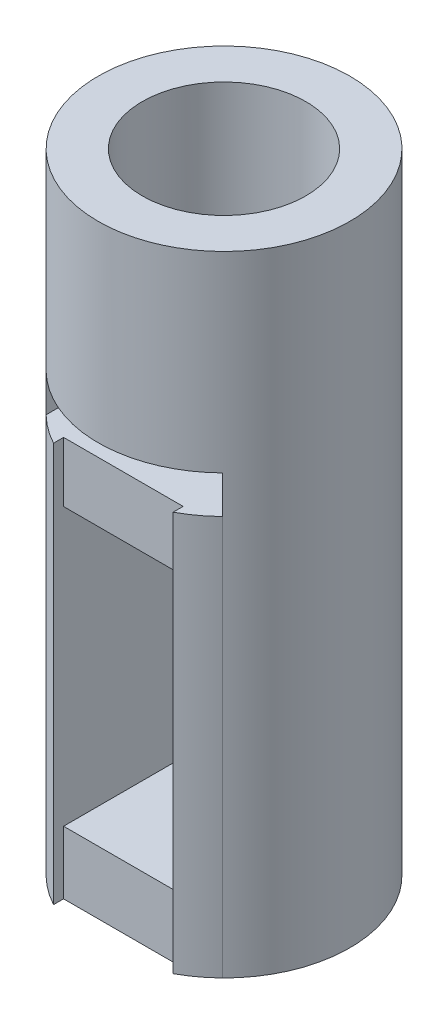
from build123d import *

# Parameters (mm, degrees)
SKETCH_1_R          = 10
EXTRUDE_1_DEPTH     = 50
SKETCH_2_W          = 9.5
SKETCH_2_H          = 32
CUT_EXTRUDE_1_DEPTH = 2
SKETCH_3_W          = 9.5
SKETCH_3_H          = 22
CUT_EXTRUDE_2_DEPTH = 14
SKETCH_4_R          = 6.5
CUT_EXTRUDE_3_DEPTH = 18
SKETCH_5_W          = 14
SKETCH_5_H          = 3
CUT_EXTRUDE_4_DEPTH = 10


with BuildPart() as part:
    # 草图1 → 凸台-拉伸1 (new body)
    with BuildSketch(Plane(origin=(0, 0, 0), x_dir=(1, 0, 0), z_dir=(0, 1, 0))):
        with Locations(Location((0, 0, 0), (0, 0, 270))):
            Circle(SKETCH_1_R)
    extrude(amount=EXTRUDE_1_DEPTH)

    # 草图2 → 切除-拉伸1 (cut)
    with BuildSketch(Plane.XY.offset(10)):
        with Locations((0, 16)):
            Rectangle(SKETCH_2_W, SKETCH_2_H)
    extrude(amount=-CUT_EXTRUDE_1_DEPTH, mode=Mode.SUBTRACT)

    # 草图3 → 切除-拉伸2 (cut)
    with BuildSketch(Plane.XY.offset(8)):
        with Locations((0, 16)):
            Rectangle(SKETCH_3_W, SKETCH_3_H)
    extrude(amount=-CUT_EXTRUDE_2_DEPTH, mode=Mode.SUBTRACT)

    # 草图4 → 切除-拉伸3 (cut)
    with BuildSketch(Plane(origin=(0, 50, 0), x_dir=(1, 0, 0), z_dir=(0, 1, 0))):
        with Locations(Location((0, 0, 0), (0, 0, 270))):
            Circle(SKETCH_4_R)
    extrude(amount=-CUT_EXTRUDE_3_DEPTH, mode=Mode.SUBTRACT)

    # 草图5 → 切除-拉伸4 (cut)
    with BuildSketch(Plane.XY.offset(10)):
        with Locations((0, 33.26002822)):
            Rectangle(SKETCH_5_W, SKETCH_5_H)
    extrude(amount=-CUT_EXTRUDE_4_DEPTH, mode=Mode.SUBTRACT)


solid = part.part
